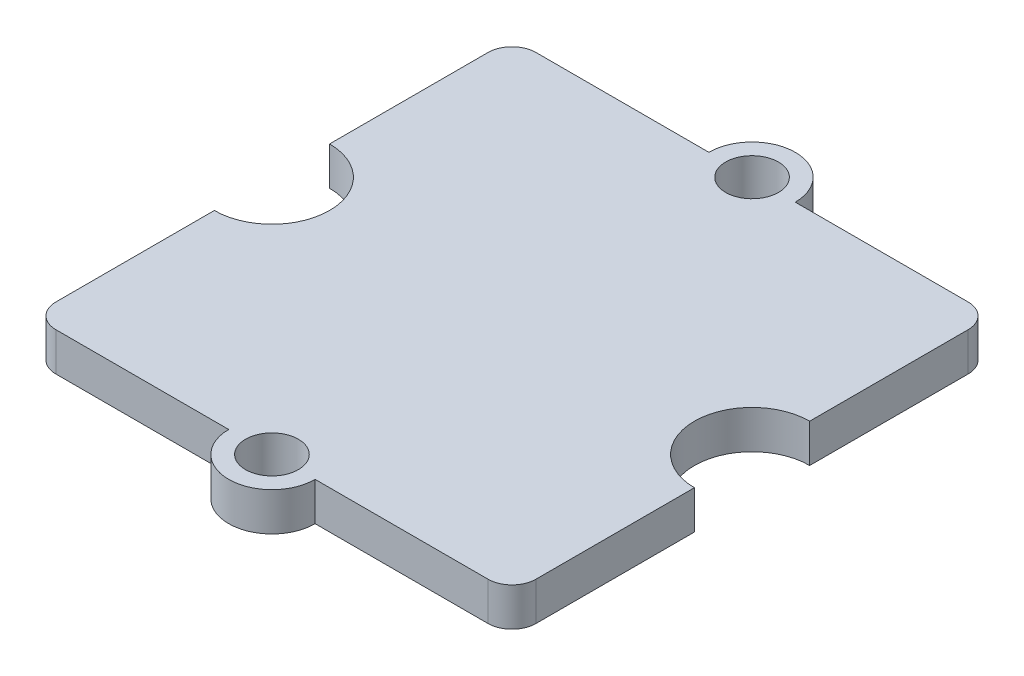
from build123d import *

# Parameters (mm, degrees)
ESQUISSE1_R        = 1.1
BOSS_EXTRU_1_DEPTH = 1.6


with BuildPart() as part:
    # Esquisse1 → Boss.-Extru.1 (new body)
    with BuildSketch(Plane(origin=(0, 0, 0), x_dir=(1, 0, 0), z_dir=(0, 1, 0))):
        with BuildLine():
            ThreePointArc((-1.8, -10), (0, -11.8), (1.8, -10))
            Line((1.8, -10), (9, -10))
            ThreePointArc((9, -10), (9.707106781, -9.707106781), (10, -9))
            Line((10, -9), (10, -2.4))
            ThreePointArc((10, -2.4), (7.6, 0), (10, 2.4))
            Line((10, 2.4), (10, 9))
            ThreePointArc((10, 9), (9.707106781, 9.707106781), (9, 10))
            Line((9, 10), (1.8, 10))
            ThreePointArc((1.8, 10), (0, 11.8), (-1.8, 10))
            Line((-1.8, 10), (-9, 10))
            ThreePointArc((-9, 10), (-9.707106781, 9.707106781), (-10, 9))
            Line((-10, 9), (-10, 2.4))
            ThreePointArc((-10, 2.4), (-7.6, 0), (-10, -2.4))
            Line((-10, -2.4), (-10, -9))
            ThreePointArc((-10, -9), (-9.707106781, -9.707106781), (-9, -10))
            Line((-9, -10), (-1.8, -10))
        make_face()
        with Locations(Location((0, -10, 0), (0, 0, 270))):
            Circle(ESQUISSE1_R, mode=Mode.SUBTRACT)
        with Locations(Location((0, 10, 0), (0, 0, 270))):
            Circle(ESQUISSE1_R, mode=Mode.SUBTRACT)
    extrude(amount=BOSS_EXTRU_1_DEPTH)


solid = part.part
